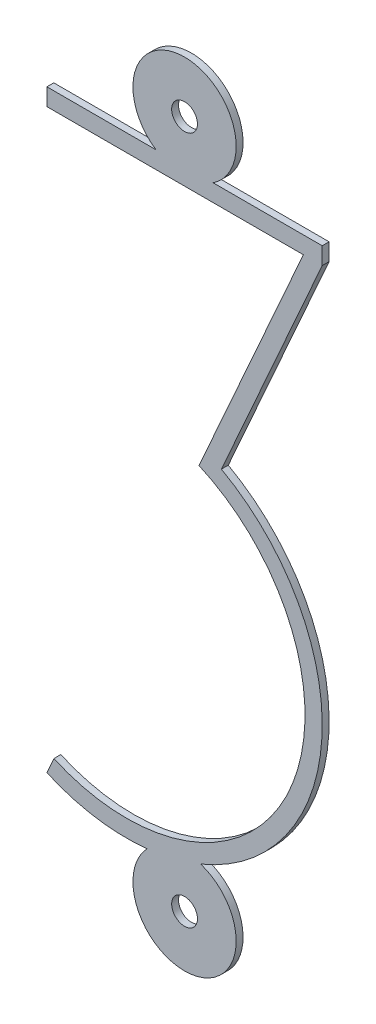
from build123d import *

# Parameters (mm, degrees)
SKETCH1_R           = 0.375
BOSS_EXTRUDE1_DEPTH = 0.1


with BuildPart() as part:
    # Sketch1 → Boss-Extrude1 (new, symmetric)
    with BuildSketch(Plane.XY):
        with BuildLine():
            Line((-4, 8.75), (-0.829156198, 8.75))
            ThreePointArc((-0.829156198, 8.75), (0, 11.5), (0.829156198, 8.75))
            Line((0.829156198, 8.75), (4, 8.75))
            Line((4, 8.75), (4, 8.25))
            Line((4, 8.25), (1.070800598, 1.663056339))
            ThreePointArc((1.070800598, 1.663056339), (3.990187346, -3.645423064), (0.468669321, -8.575096822))
            ThreePointArc((0.468669321, -8.575096822), (0.367162541, -11.454369853), (-1.088850392, -8.968300032))
            ThreePointArc((-1.088850392, -8.968300032), (-2.57467118, -8.930560768), (-4, -8.509223116))
            Line((-4, -8.509223116), (-3.796834113, -8.052360311))
            ThreePointArc((-3.796834113, -8.052360311), (3.052360311, -5.419717925), (0.419717925, 1.429476498))
            Line((0.419717925, 1.429476498), (3.452789771, 8.25))
            Line((3.452789771, 8.25), (-4, 8.25))
            Line((-4, 8.25), (-4, 8.75))
        make_face()
        with Locations((0, 10)):
            Circle(SKETCH1_R, mode=Mode.SUBTRACT)
        with Locations((0, -10)):
            Circle(SKETCH1_R, mode=Mode.SUBTRACT)
    extrude(amount=BOSS_EXTRUDE1_DEPTH, both=True)


solid = part.part
